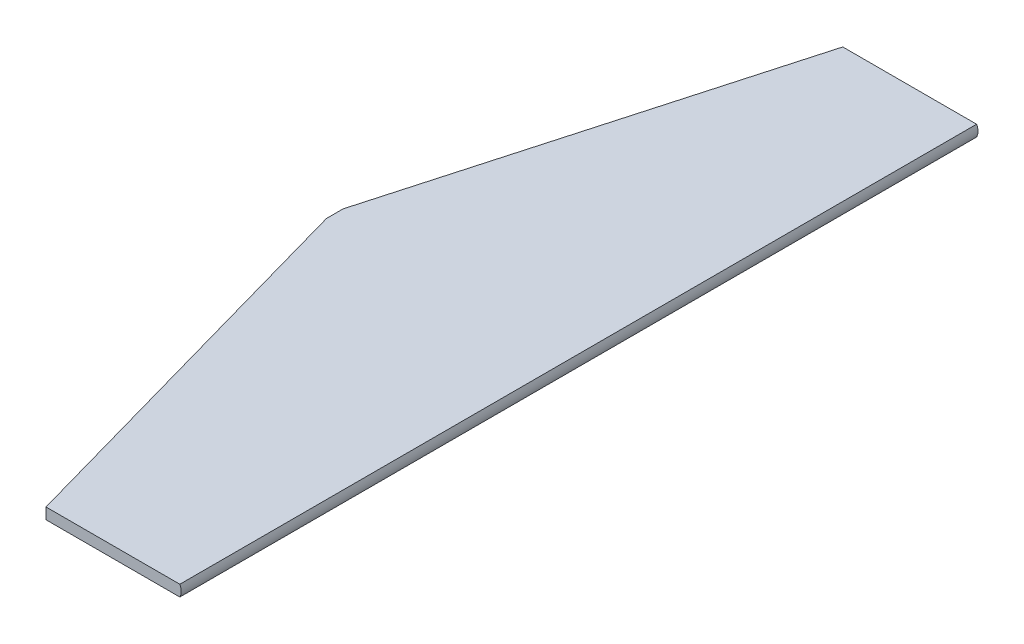
from build123d import *

# Parameters (mm, degrees)
BOSS_EXTRUDE1_DEPTH = 10
SCALE2_SCALE        = 0.6
BOSS_EXTRUDE2_DEPTH = 430.08


with BuildPart() as part:
    # Sketch1 → Boss-Extrude1 (new body)
    with BuildSketch(Plane(origin=(0, 0, 0), x_dir=(1, 0, 0), z_dir=(0, 1, 0))):
        Polygon((219, 0), (219, 350.9), (98.6, 350.9), (0, 0), (0, -15), (98.6, -365.9), (219, -365.9), (219, -15), align=None)
    extrude(amount=BOSS_EXTRUDE1_DEPTH)


with BuildPart() as part_1:
    # Scale2: scaled about (131.165360429, 5, 7.5)
    add(part.part.scale(SCALE2_SCALE).moved(Location((52.466144172, 2, 3))))

    # Sketch2 → Boss-Extrude2 (add)
    with BuildSketch(Plane.XY.offset(222.54)):
        with BuildLine():
            Line((183.866144171, 8), (183.866144171, 2))
            ThreePointArc((183.866144171, 2), (184.617619122, 5), (183.866144171, 8))
        make_face()
    extrude(amount=-BOSS_EXTRUDE2_DEPTH)


solid = part_1.part
